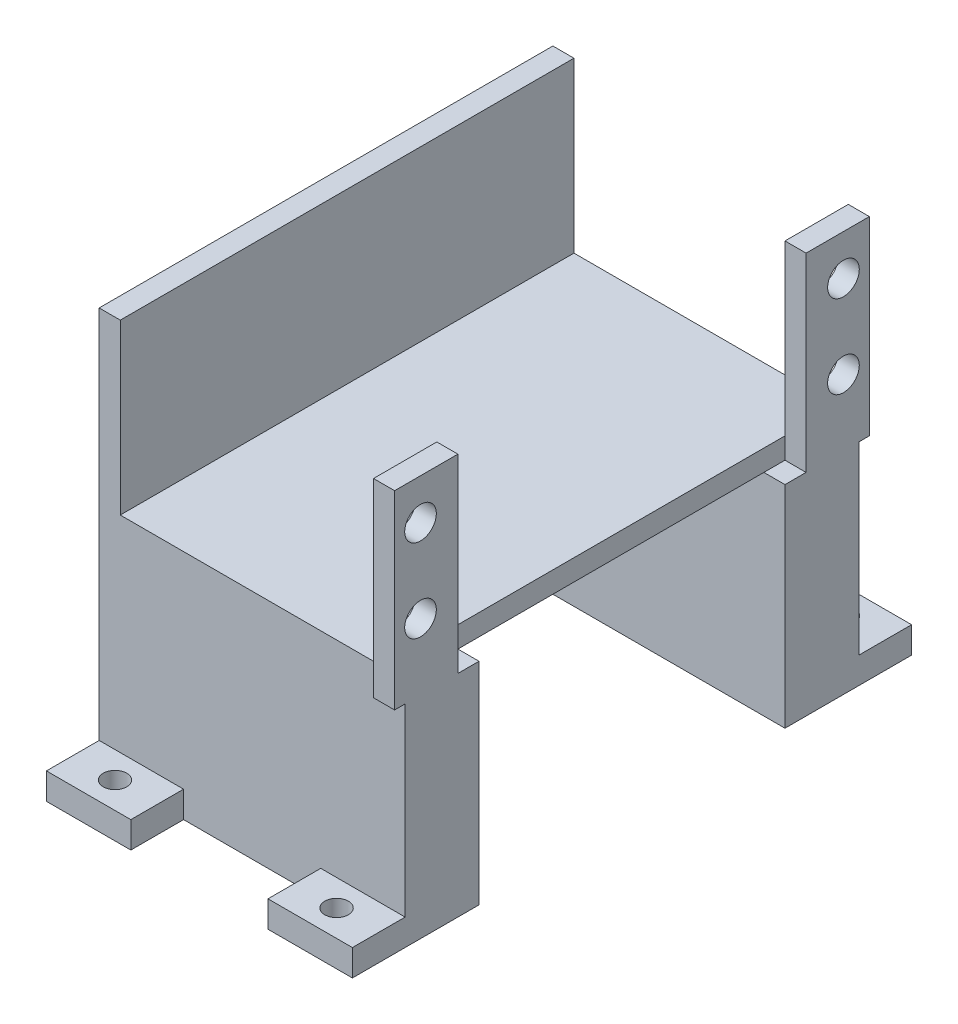
from build123d import *

# Parameters (mm, degrees)
SKETCH1_W           = 31.75
SKETCH1_H           = 54.61
BOSS_EXTRUDE1_DEPTH = 2.54
SKETCH2_W           = 2.54
SKETCH2_H           = 7.62
SKETCH2_H_2         = 54.61
BOSS_EXTRUDE2_DEPTH = 22.86
SKETCH3_W           = 36.83
SKETCH3_H           = 8.89
BOSS_EXTRUDE3_DEPTH = 25.4
SKETCH4_R           = 1.905
CUT_EXTRUDE1_DEPTH  = 2.54
SKETCH5_W           = 10.16
SKETCH5_H           = 3.175
BOSS_EXTRUDE4_DEPTH = 6.35
SKETCH6_W           = 10.16
SKETCH6_H           = 3.175
BOSS_EXTRUDE5_DEPTH = 6.35
SKETCH7_R           = 1.4224
CUT_EXTRUDE2_DEPTH  = 84.214078887


with BuildPart() as part:
    # Sketch1 → Boss-Extrude1 (new body)
    with BuildSketch(Plane(origin=(0, 0, 0), x_dir=(1, 0, 0), z_dir=(0, 1, 0))):
        with Locations((15.875, 27.305)):
            Rectangle(SKETCH1_W, SKETCH1_H)
    extrude(amount=BOSS_EXTRUDE1_DEPTH)

    # Sketch2 → Boss-Extrude2 (add)
    with BuildSketch(Plane(origin=(0, 0, 0), x_dir=(1, 0, 0), z_dir=(0, 1, 0))):
        with Locations((33.02, 2.54)):
            Rectangle(SKETCH2_W, SKETCH2_H)
        with Locations((33.02, 52.07)):
            Rectangle(SKETCH2_W, SKETCH2_H)
        with Locations((-1.27, 27.305)):
            Rectangle(SKETCH2_W, SKETCH2_H_2)
    extrude(amount=BOSS_EXTRUDE2_DEPTH)

    # Sketch3 → Boss-Extrude3 (add)
    with BuildSketch(Plane.XZ):
        with Locations((15.875, -4.445)):
            Rectangle(SKETCH3_W, SKETCH3_H)
        with Locations((15.875, -50.165)):
            Rectangle(SKETCH3_W, SKETCH3_H)
    extrude(amount=BOSS_EXTRUDE3_DEPTH)

    # Sketch4 → Cut-Extrude1 (cut)
    with BuildSketch(Plane(origin=(34.29, 0, 0), x_dir=(0, 0, -1), z_dir=(1, 0, 0))):
        with Locations((1.85, 17.967840319)):
            Circle(SKETCH4_R)
        with Locations((1.85, 7.967840319)):
            Circle(SKETCH4_R)
        with Locations((52.76, 17.967840319)):
            Circle(SKETCH4_R)
        with Locations((52.76, 7.967840319)):
            Circle(SKETCH4_R)
    extrude(amount=-CUT_EXTRUDE1_DEPTH, mode=Mode.SUBTRACT)

    # Sketch5 → Boss-Extrude4 (add)
    with BuildSketch(Plane(origin=(0, 0, -54.61), x_dir=(-1, 0, 0), z_dir=(0, 0, -1))):
        with Locations((-29.21, -23.8125)):
            Rectangle(SKETCH5_W, SKETCH5_H)
        with Locations((-2.54, -23.8125)):
            Rectangle(SKETCH5_W, SKETCH5_H)
    extrude(amount=BOSS_EXTRUDE4_DEPTH)

    # Sketch6 → Boss-Extrude5 (add)
    with BuildSketch(Plane.XY):
        with Locations((29.21, -23.8125)):
            Rectangle(SKETCH6_W, SKETCH6_H)
        with Locations((2.54, -23.8125)):
            Rectangle(SKETCH6_W, SKETCH6_H)
    extrude(amount=BOSS_EXTRUDE5_DEPTH)

    # Sketch7 → Cut-Extrude2 (cut, through all)
    with BuildSketch(Plane(origin=(0, -22.225, 0), x_dir=(1, 0, 0), z_dir=(0, 1, 0))):
        with Locations(Location((29.21, 57.785, 0), (0, 0, 270))):
            Circle(SKETCH7_R)
        with Locations(Location((2.54, 57.785, 0), (0, 0, 270))):
            Circle(SKETCH7_R)
        with Locations(Location((2.54, -3.175, 0), (0, 0, 270))):
            Circle(SKETCH7_R)
        with Locations(Location((29.21, -3.175, 0), (0, 0, 270))):
            Circle(SKETCH7_R)
    extrude(amount=-CUT_EXTRUDE2_DEPTH, mode=Mode.SUBTRACT)


solid = part.part
